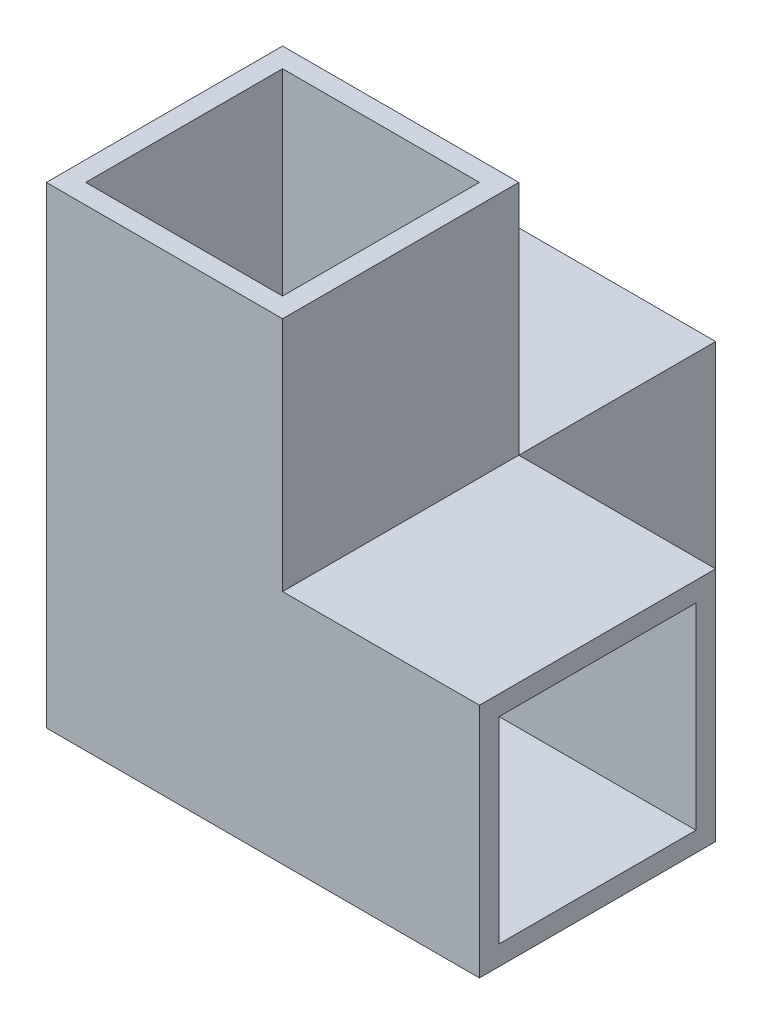
from build123d import *

# Parameters (mm, degrees)
EXTRUDE_1_DEPTH     = 48
SKETCH_2_W          = 48
SKETCH_2_H          = 48
EXTRUDE_2_DEPTH     = 48
SKETCH_3_W          = 40
SKETCH_3_H          = 40
CUT_EXTRUDE_1_DEPTH = 84
SKETCH_4_W          = 40
SKETCH_4_H          = 40
CUT_EXTRUDE_2_DEPTH = 84
SKETCH_5_W          = 40
SKETCH_5_H          = 40
CUT_EXTRUDE_3_DEPTH = 84
SKETCH_6_W          = 48
SKETCH_6_H          = 48
EXTRUDE_5_DEPTH     = 44


with BuildPart() as part:
    # 草图1 → 凸台-拉伸1 (new body)
    with BuildSketch(Plane(origin=(0, 0, 0), x_dir=(1, 0, 0), z_dir=(0, 1, 0))):
        Polygon((0, 88), (0, 0), (88, 0), (88, 48), (48, 48), (48, 88), align=None)
    extrude(amount=EXTRUDE_1_DEPTH)

    # 草图2 → 凸台-拉伸2 (add)
    with BuildSketch(Plane(origin=(0, 48, 0), x_dir=(1, 0, 0), z_dir=(0, 1, 0))):
        with Locations((24, 24)):
            Rectangle(SKETCH_2_W, SKETCH_2_H)
    extrude(amount=EXTRUDE_2_DEPTH)

    # 草图3 → 切除-拉伸1 (cut)
    with BuildSketch(Plane(origin=(88, 0, 0), x_dir=(0, 0, -1), z_dir=(1, 0, 0))):
        with Locations((24, 24)):
            Rectangle(SKETCH_3_W, SKETCH_3_H)
    extrude(amount=-CUT_EXTRUDE_1_DEPTH, mode=Mode.SUBTRACT)

    # 草图4 → 切除-拉伸2 (cut)
    with BuildSketch(Plane(origin=(0, 0, -88), x_dir=(-1, 0, 0), z_dir=(0, 0, -1))):
        with Locations((-24, 24)):
            Rectangle(SKETCH_4_W, SKETCH_4_H)
    extrude(amount=-CUT_EXTRUDE_2_DEPTH, mode=Mode.SUBTRACT)

    # 草图5 → 切除-拉伸3 (cut)
    with BuildSketch(Plane(origin=(0, 96, 0), x_dir=(1, 0, 0), z_dir=(0, 1, 0))):
        with Locations((24, 24)):
            Rectangle(SKETCH_5_W, SKETCH_5_H)
    extrude(amount=-CUT_EXTRUDE_3_DEPTH, mode=Mode.SUBTRACT)

    # 草图6 → 凸台-拉伸5 (add)
    with BuildSketch(Plane(origin=(4, 0, 0), x_dir=(0, 0, -1), z_dir=(1, 0, 0))):
        with Locations((24, 24)):
            Rectangle(SKETCH_6_W, SKETCH_6_H)
    extrude(amount=EXTRUDE_5_DEPTH)


solid = part.part
